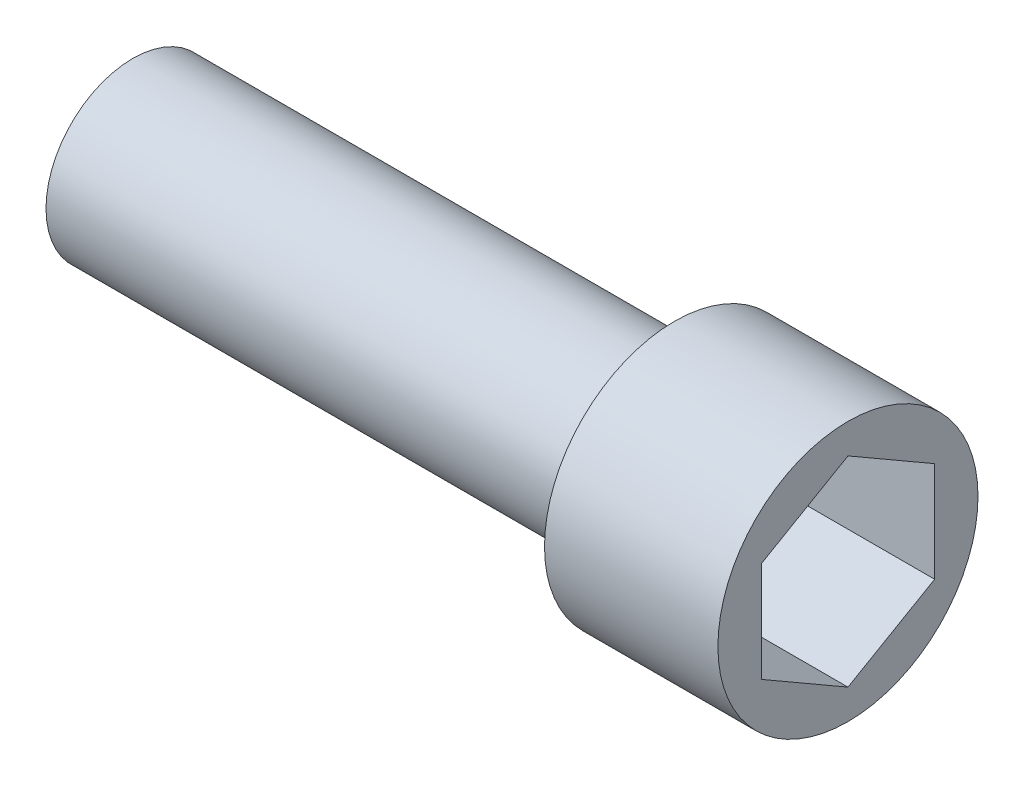
from build123d import *

# Parameters (mm, degrees)
SKETCH1_R           = 6
BOSS_EXTRUDE1_DEPTH = 8
CUT_EXTRUDE1_DEPTH  = 6
SKETCH3_R           = 4
BOSS_EXTRUDE2_DEPTH = 25


with BuildPart() as part:
    # Sketch1 → Boss-Extrude1 (new body)
    with BuildSketch(Plane.YZ):
        with Locations(Location((0, 0, 0), (0, 0, 270))):
            Circle(SKETCH1_R)
    extrude(amount=BOSS_EXTRUDE1_DEPTH)

    # Sketch2 → Cut-Extrude1 (cut)
    with BuildSketch(Plane.YZ.offset(8)):
        Polygon((4.618802154, 0), (2.309401077, 4), (-2.309401077, 4), (-4.618802154, 0), (-2.309401077, -4), (2.309401077, -4), align=None)
    extrude(amount=-CUT_EXTRUDE1_DEPTH, mode=Mode.SUBTRACT)

    # Sketch3 → Boss-Extrude2 (add)
    with BuildSketch(Plane(origin=(0, 0, 0), x_dir=(0, -1, 0), z_dir=(-1, 0, 0))):
        with Locations(Location((0, 0, 0), (0, 0, 90))):
            Circle(SKETCH3_R)
    extrude(amount=BOSS_EXTRUDE2_DEPTH)


solid = part.part
